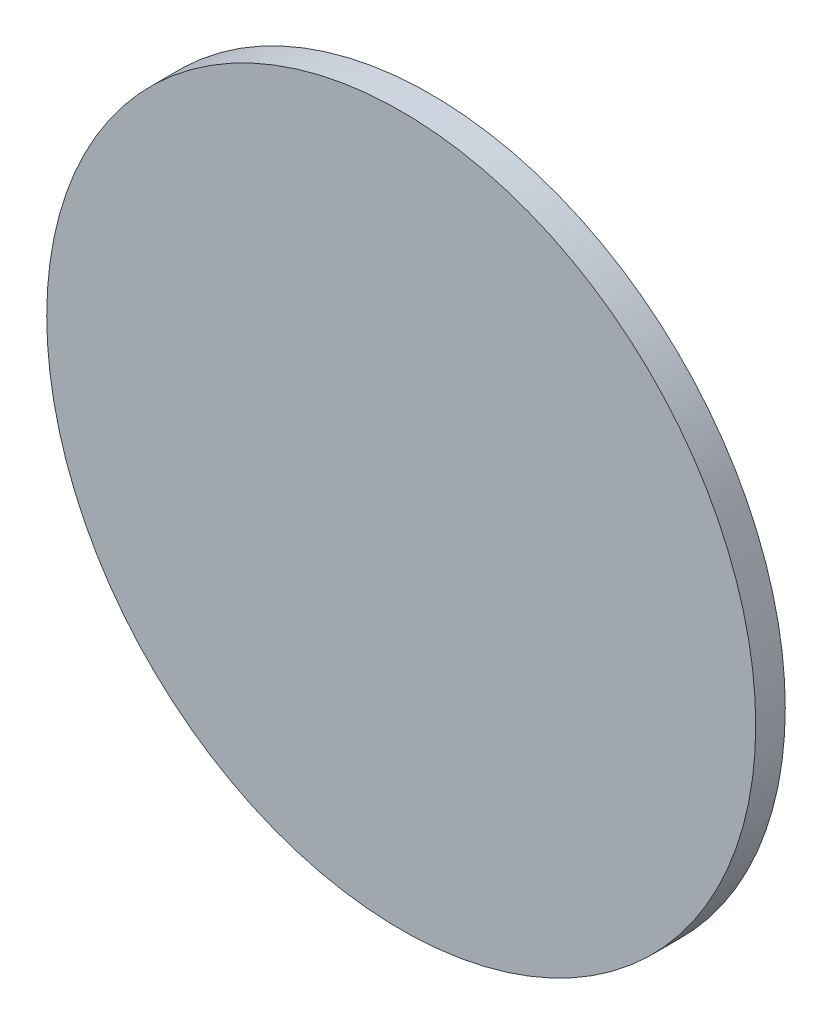
from build123d import *

# Parameters (mm, degrees)
ESQUISSE1_R        = 76.2
BOSS_EXTRU_1_DEPTH = 6.35


with BuildPart() as part:
    # Esquisse1 → Boss.-Extru.1 (new body)
    with BuildSketch(Plane.XY):
        Circle(ESQUISSE1_R)
    extrude(amount=BOSS_EXTRU_1_DEPTH)


solid = part.part
